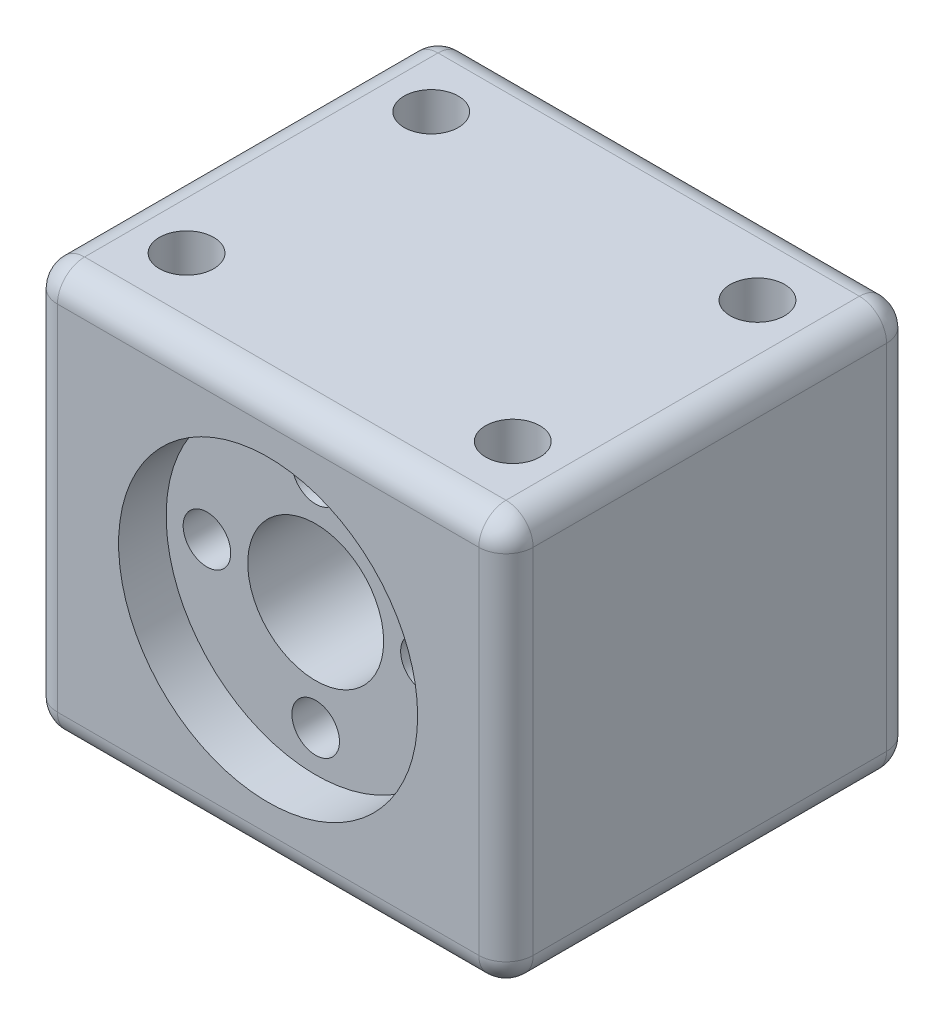
from build123d import *

# Parameters (mm, degrees)
CROQUIS1_W                 = 35
CROQUIS1_H                 = 30
CROQUIS1_R                 = 5
CROQUIS1_R_2               = 1.75
SALIENTE_EXTRUIR1_DEPTH    = 30
CROQUIS2_R                 = 11
CORTAR_EXTRUIR1_DEPTH      = 3.5
REDONDEO2_R                = 2
CORTAR_EXTRUIR2_DEPTH      = 10
CORTAR_EXTRUIR2_DEPTH_BACK = 31.5
CROQUIS3_R                 = 2


with BuildPart() as part:
    # Croquis1 → Saliente-Extruir1 (new body)
    with BuildSketch(Plane.XY):
        Rectangle(CROQUIS1_W, CROQUIS1_H)
        Circle(CROQUIS1_R, mode=Mode.SUBTRACT)
        with Locations((0, 8)):
            Circle(CROQUIS1_R_2, mode=Mode.SUBTRACT)
        with Locations((8, 0)):
            Circle(CROQUIS1_R_2, mode=Mode.SUBTRACT)
        with Locations((0, -8)):
            Circle(CROQUIS1_R_2, mode=Mode.SUBTRACT)
        with Locations((-8, 0)):
            Circle(CROQUIS1_R_2, mode=Mode.SUBTRACT)
    extrude(amount=SALIENTE_EXTRUIR1_DEPTH)

    # Croquis2 → Cortar-Extruir1 (cut)
    with BuildSketch(Plane.XY.offset(30)):
        Circle(CROQUIS2_R)
    extrude(amount=-CORTAR_EXTRUIR1_DEPTH, mode=Mode.SUBTRACT)

    # Redondeo2
    redondeo2_edges = [part.edges().sort_by_distance(p)[0] for p in [
        (-17.5, 0, 30),
        (0, -15, 30),
        (17.5, 0, 30),
        (0, -15, 0),
        (-17.5, 0, 0),
        (0, 15, 0),
        (17.5, 0, 0),
        (17.5, -15, 15),
        (-17.5, -15, 15),
        (-17.5, 15, 15),
        (17.5, 15, 15),
        (0, 15, 30),
    ]]
    fillet(redondeo2_edges, radius=REDONDEO2_R)

    # Croquis3 → Cortar-Extruir2 (cut, two sides: drawn at the far end of the back side and taken through both)
    with BuildSketch(Plane(origin=(0, 15, 0), x_dir=(1, 0, 0), z_dir=(0, 1, 0)).offset(-CORTAR_EXTRUIR2_DEPTH_BACK)):
        with Locations(Location((-12, -24, 0), (0, 0, 90))):
            Circle(CROQUIS3_R)
        with Locations(Location((12, -24, 0), (0, 0, 90))):
            Circle(CROQUIS3_R)
        with Locations(Location((-12, -6, 0), (0, 0, 90))):
            Circle(CROQUIS3_R)
        with Locations(Location((12, -6, 0), (0, 0, 90))):
            Circle(CROQUIS3_R)
    extrude(amount=CORTAR_EXTRUIR2_DEPTH + CORTAR_EXTRUIR2_DEPTH_BACK, mode=Mode.SUBTRACT)


solid = part.part
